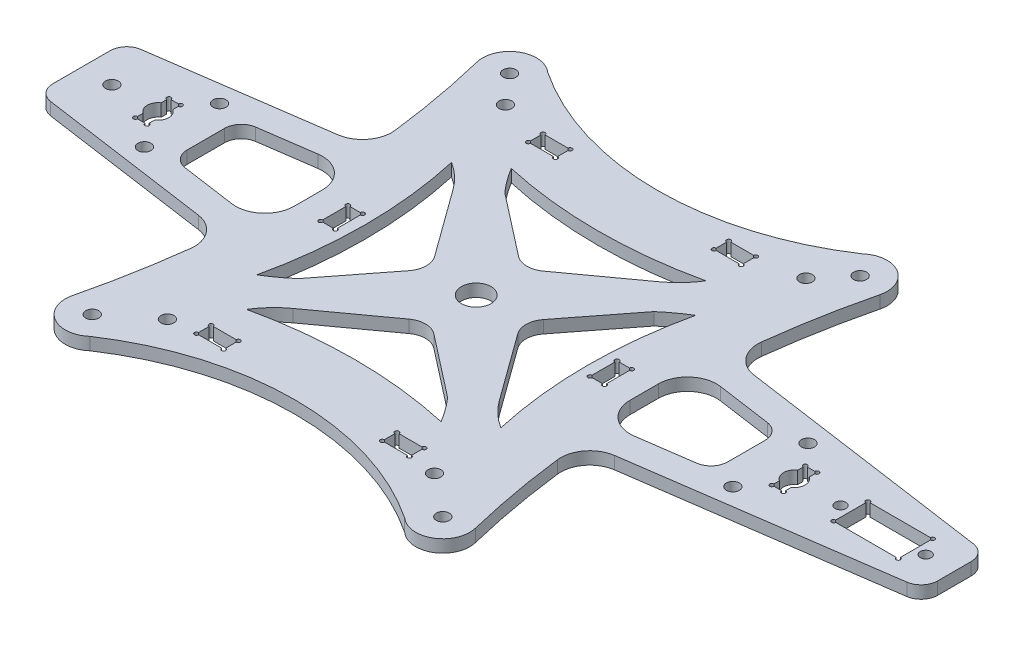
from build123d import *

# Parameters (mm, degrees)
SKETCH_1_R             = 1.55
SKETCH_1_R_2           = 1.3
SKETCH_1_W             = 6.5
SKETCH_1_H             = 3.5
SKETCH_1_W_2           = 3.5
SKETCH_1_H_2           = 6.5
SKETCH_1_W_3           = 15.5
SKETCH_1_H_3           = 8.2
EXTRUDE_1_DEPTH        = 3
FILLET_1_R             = 4
FILLET_2_R             = 7
SKETCH_2_R             = 0.5
CUT_EXTRUDE_4998_DEPTH = 128.780965393
SKETCH_3_R             = 3.55
CUT_EXTRUDE_2_DEPTH    = 128.780965393
FILLET_3_R             = 5


with BuildPart() as part:
    # 草图1 → 凸台-拉伸1 (new body)
    with BuildSketch(Plane(origin=(0, 0, 0), x_dir=(1, 0, 0), z_dir=(0, 1, 0))):
        with BuildLine():
            Line((114.591143215, 7.468307572), (114.591143215, -7.468307572))
            Line((114.591143215, -7.468307572), (43.193640968, -17.646273029))
            ThreePointArc((43.193640968, -17.646273029), (45.143245402, -33.15226541), (48.27557779, -48.463217404))
            ThreePointArc((48.27557779, -48.463217404), (45.335063646, -55.533708325), (37.709796983, -54.831018053))
            ThreePointArc((37.709796983, -54.831018053), (0, -43.436211003), (-37.709796983, -54.831018053))
            ThreePointArc((-37.709796983, -54.831018053), (-45.335063646, -55.533708325), (-48.27557779, -48.463217404))
            ThreePointArc((-48.27557779, -48.463217404), (-45.143245402, -33.15226541), (-43.193640968, -17.646273029))
            Line((-43.193640968, -17.646273029), (-94.579518436, -10.321035179))
            Line((-94.579518436, -10.321035179), (-94.579518436, 10.321035179))
            Line((-94.579518436, 10.321035179), (-43.193640968, 17.646273029))
            ThreePointArc((-43.193640968, 17.646273029), (-45.143245402, 33.15226541), (-48.27557779, 48.463217404))
            ThreePointArc((-48.27557779, 48.463217404), (-45.335063646, 55.533708325), (-37.709796983, 54.831018053))
            ThreePointArc((-37.709796983, 54.831018053), (0, 43.436211003), (37.709796983, 54.831018053))
            ThreePointArc((37.709796983, 54.831018053), (45.335063646, 55.533708325), (48.27557779, 48.463217404))
            ThreePointArc((48.27557779, 48.463217404), (45.143245402, 33.15226541), (43.193640968, 17.646273029))
            Line((43.193640968, 17.646273029), (114.591143215, 7.468307572))
        make_face()
        with Locations(Location((-36, 43, 0), (0, 0, 270))):
            Circle(SKETCH_1_R, mode=Mode.SUBTRACT)
        with Locations(Location((-32, -42, 0), (0, 0, 270))):
            Circle(SKETCH_1_R, mode=Mode.SUBTRACT)
        with Locations(Location((32, -42, 0), (0, 0, 90))):
            Circle(SKETCH_1_R, mode=Mode.SUBTRACT)
        with Locations(Location((36, 43, 0), (0, 0, 90))):
            Circle(SKETCH_1_R, mode=Mode.SUBTRACT)
        with Locations(Location((42, 50, 0), (0, 0, 270))):
            Circle(SKETCH_1_R, mode=Mode.SUBTRACT)
        with Locations(Location((42, -50, 0), (0, 0, 90))):
            Circle(SKETCH_1_R, mode=Mode.SUBTRACT)
        with Locations(Location((-42, -50, 0), (0, 0, 270))):
            Circle(SKETCH_1_R, mode=Mode.SUBTRACT)
        with Locations(Location((-42, 50, 0), (0, 0, 90))):
            Circle(SKETCH_1_R, mode=Mode.SUBTRACT)
        with Locations(Location((107.7, 0, 0), (0, 0, 270))):
            Circle(SKETCH_1_R_2, mode=Mode.SUBTRACT)
        with Locations(Location((87.3, 0, 0), (0, 0, 270))):
            Circle(SKETCH_1_R_2, mode=Mode.SUBTRACT)
        with Locations(Location((70.5, 9, 0), (0, 0, 270))):
            Circle(SKETCH_1_R, mode=Mode.SUBTRACT)
        with Locations(Location((70.5, -9, 0), (0, 0, 90))):
            Circle(SKETCH_1_R, mode=Mode.SUBTRACT)
        with Locations(Location((-70.5, -9, 0), (0, 0, 270))):
            Circle(SKETCH_1_R, mode=Mode.SUBTRACT)
        with Locations(Location((-70.5, 9, 0), (0, 0, 90))):
            Circle(SKETCH_1_R, mode=Mode.SUBTRACT)
        with Locations(Location((-87.3, 0, 0), (0, 0, 270))):
            Circle(SKETCH_1_R, mode=Mode.SUBTRACT)
        with Locations((-22.25, 39.75)):
            Rectangle(SKETCH_1_W, SKETCH_1_H, mode=Mode.SUBTRACT)
        with Locations((-32.25, 0)):
            Rectangle(SKETCH_1_W_2, SKETCH_1_H_2, mode=Mode.SUBTRACT)
        with Locations((-22.25, -39.75)):
            Rectangle(SKETCH_1_W, SKETCH_1_H, mode=Mode.SUBTRACT)
        with Locations((22.25, 39.75)):
            Rectangle(SKETCH_1_W, SKETCH_1_H, mode=Mode.SUBTRACT)
        with Locations((22.25, -39.75)):
            Rectangle(SKETCH_1_W, SKETCH_1_H, mode=Mode.SUBTRACT)
        with Locations((32.25, 0)):
            Rectangle(SKETCH_1_W_2, SKETCH_1_H_2, mode=Mode.SUBTRACT)
        with BuildLine():
            Line((77.65, -2.151778405), (77.65, -4))
            Line((77.65, -4), (74.85, -4))
            Line((74.85, -4), (74.85, -2.176778405))
            ThreePointArc((74.85, -2.176778405), (73.652957971, 0), (74.85, 2.176778405))
            Line((74.85, 2.176778405), (74.85, 4))
            Line((74.85, 4), (77.65, 4))
            Line((77.65, 4), (77.65, 2.151778405))
            ThreePointArc((77.65, 2.151778405), (78.8083942, 0), (77.65, -2.151778405))
        make_face(mode=Mode.SUBTRACT)
        with Locations((97.5, 0)):
            Rectangle(SKETCH_1_W_3, SKETCH_1_H_3, mode=Mode.SUBTRACT)
        with BuildLine():
            Line((-74.85, -2.176778405), (-74.85, -4))
            Line((-74.85, -4), (-77.65, -4))
            Line((-77.65, -4), (-77.65, -2.151778405))
            ThreePointArc((-77.65, -2.151778405), (-78.8083942, 0), (-77.65, 2.151778405))
            Line((-77.65, 2.151778405), (-77.65, 4))
            Line((-77.65, 4), (-74.85, 4))
            Line((-74.85, 4), (-74.85, 2.176778405))
            ThreePointArc((-74.85, 2.176778405), (-73.652957971, 0), (-74.85, -2.176778405))
        make_face(mode=Mode.SUBTRACT)
        with BuildLine():
            Line((-24.712844908, 19.183966516), (-10.803008194, 0))
            Line((-10.803008194, 0), (-24.712844908, -17.876467816))
            ThreePointArc((-24.712844908, -17.876467816), (-27.509480803, -20.102319762), (-30.485660459, -22.081699431))
            ThreePointArc((-30.485660459, -22.081699431), (-27.899245538, 1.245393512), (-30.485660459, 24.572486455))
            ThreePointArc((-30.485660459, 24.572486455), (-27.339184273, 22.156842317), (-24.712844908, 19.183966516))
        make_face(mode=Mode.SUBTRACT)
        with BuildLine():
            Line((19.183966516, 24.712844908), (0, 10.803008194))
            Line((0, 10.803008194), (-17.876467816, 24.712844908))
            ThreePointArc((-17.876467816, 24.712844908), (-20.102319762, 27.509480803), (-22.081699431, 30.485660459))
            ThreePointArc((-22.081699431, 30.485660459), (1.245393512, 27.899245538), (24.572486455, 30.485660459))
            ThreePointArc((24.572486455, 30.485660459), (22.156842317, 27.339184273), (19.183966516, 24.712844908))
        make_face(mode=Mode.SUBTRACT)
        with BuildLine():
            Line((24.712844908, -19.183966516), (10.803008194, 0))
            Line((10.803008194, 0), (24.712844908, 17.876467816))
            ThreePointArc((24.712844908, 17.876467816), (27.509480803, 20.102319762), (30.485660459, 22.081699431))
            ThreePointArc((30.485660459, 22.081699431), (27.899245538, -1.245393512), (30.485660459, -24.572486455))
            ThreePointArc((30.485660459, -24.572486455), (27.339184273, -22.156842317), (24.712844908, -19.183966516))
        make_face(mode=Mode.SUBTRACT)
        with BuildLine():
            Line((-19.183966516, -24.712844908), (0, -10.803008194))
            Line((0, -10.803008194), (17.876467816, -24.712844908))
            ThreePointArc((17.876467816, -24.712844908), (20.102319762, -27.509480803), (22.081699431, -30.485660459))
            ThreePointArc((22.081699431, -30.485660459), (-1.245393512, -27.899245538), (-24.572486455, -30.485660459))
            ThreePointArc((-24.572486455, -30.485660459), (-22.156842317, -27.339184273), (-19.183966516, -24.712844908))
        make_face(mode=Mode.SUBTRACT)
        Polygon((-64.75, -7.957119899), (-64.75, 7.957119899), (-40.25, 11.449681205), (-40.25, -11.449681205), align=None, mode=Mode.SUBTRACT)
        Polygon((64.75, 7.957119899), (40.25, 11.449681205), (40.25, -11.449681205), (64.75, -7.957119899), align=None, mode=Mode.SUBTRACT)
    extrude(amount=EXTRUDE_1_DEPTH)

    # 圆角1
    fillet_1_edges = [part.edges().sort_by_distance(p)[0] for p in [
        (-64.75, 1.5, -7.957119899),
        (-64.75, 1.5, 7.957119899),
        (64.75, 1.5, 7.957119899),
        (64.75, 1.5, -7.957119899),
        (114.591143215, 1.5, -7.468307572),
        (114.591143215, 1.5, 7.468307572),
        (-94.579518436, 1.5, 10.321035179),
        (-94.579518436, 1.5, -10.321035179),
    ]]
    fillet(fillet_1_edges, radius=FILLET_1_R)

    # 圆角2
    fillet_2_edges = [part.edges().sort_by_distance(p)[0] for p in [
        (-40.25, 1.5, -11.449681205),
        (-40.25, 1.5, 11.449681205),
        (40.25, 1.5, -11.449681205),
        (40.25, 1.5, 11.449681205),
        (-43.193640968, 1.5, -17.646273029),
        (43.193640968, 1.5, -17.646273029),
        (43.193640968, 1.5, 17.646273029),
        (-43.193640968, 1.5, 17.646273029),
    ]]
    fillet(fillet_2_edges, radius=FILLET_2_R)

    # 草图2 → Cut-Extrude 4998 (cut, through all)
    with BuildSketch(Plane(origin=(0, 3, 0), x_dir=(1, 0, 0), z_dir=(0, 1, 0))):
        with Locations((-77.65, 4)):
            Circle(SKETCH_2_R)
        with Locations((-74.85, 4)):
            Circle(SKETCH_2_R)
        with Locations((-77.65, -4)):
            Circle(SKETCH_2_R)
        with Locations((-74.85, -4)):
            Circle(SKETCH_2_R)
        with Locations((-25.5, 41.5)):
            Circle(SKETCH_2_R)
        with Locations((-19, 41.5)):
            Circle(SKETCH_2_R)
        with Locations((-25.5, 38)):
            Circle(SKETCH_2_R)
        with Locations((-19, 38)):
            Circle(SKETCH_2_R)
        with Locations((-34, 3.25)):
            Circle(SKETCH_2_R)
        with Locations((-30.5, 3.25)):
            Circle(SKETCH_2_R)
        with Locations((-34, -3.25)):
            Circle(SKETCH_2_R)
        with Locations((-30.5, -3.25)):
            Circle(SKETCH_2_R)
        with Locations((-25.5, -38)):
            Circle(SKETCH_2_R)
        with Locations((-19, -38)):
            Circle(SKETCH_2_R)
        with Locations((-25.5, -41.5)):
            Circle(SKETCH_2_R)
        with Locations((-19, -41.5)):
            Circle(SKETCH_2_R)
        with Locations((19, -41.5)):
            Circle(SKETCH_2_R)
        with Locations((25.5, -41.5)):
            Circle(SKETCH_2_R)
        with Locations((19, -38)):
            Circle(SKETCH_2_R)
        with Locations((25.5, -38)):
            Circle(SKETCH_2_R)
        with Locations((30.5, -3.25)):
            Circle(SKETCH_2_R)
        with Locations((34, -3.25)):
            Circle(SKETCH_2_R)
        with Locations((30.5, 3.25)):
            Circle(SKETCH_2_R)
        with Locations((34, 3.25)):
            Circle(SKETCH_2_R)
        with Locations((19, 38)):
            Circle(SKETCH_2_R)
        with Locations((25.5, 38)):
            Circle(SKETCH_2_R)
        with Locations((19, 41.5)):
            Circle(SKETCH_2_R)
        with Locations((25.5, 41.5)):
            Circle(SKETCH_2_R)
        with Locations((74.85, -4)):
            Circle(SKETCH_2_R)
        with Locations((77.65, -4)):
            Circle(SKETCH_2_R)
        with Locations((74.85, 4)):
            Circle(SKETCH_2_R)
        with Locations((77.65, 4)):
            Circle(SKETCH_2_R)
        with Locations((89.75, 4.1)):
            Circle(SKETCH_2_R)
        with Locations((105.25, 4.1)):
            Circle(SKETCH_2_R)
        with Locations((89.75, -4.1)):
            Circle(SKETCH_2_R)
        with Locations((105.25, -4.1)):
            Circle(SKETCH_2_R)
    extrude(amount=-CUT_EXTRUDE_4998_DEPTH, mode=Mode.SUBTRACT)

    # 草图3 → 切除-拉伸2 (cut, through all)
    with BuildSketch(Plane(origin=(0, 0, 0), x_dir=(1, 0, 0), z_dir=(0, 1, 0))):
        with Locations(Location((0, 0, 0), (0, 0, 270))):
            Circle(SKETCH_3_R)
    extrude(amount=CUT_EXTRUDE_2_DEPTH, mode=Mode.SUBTRACT)

    # 圆角3
    fillet_3_edges = [part.edges().sort_by_distance(p)[0] for p in [
        (0, 1.5, -10.803008194),
        (-10.803008194, 1.5, 0),
        (10.803008194, 1.5, 0),
        (0, 1.5, 10.803008194),
    ]]
    fillet(fillet_3_edges, radius=FILLET_3_R)


solid = part.part
